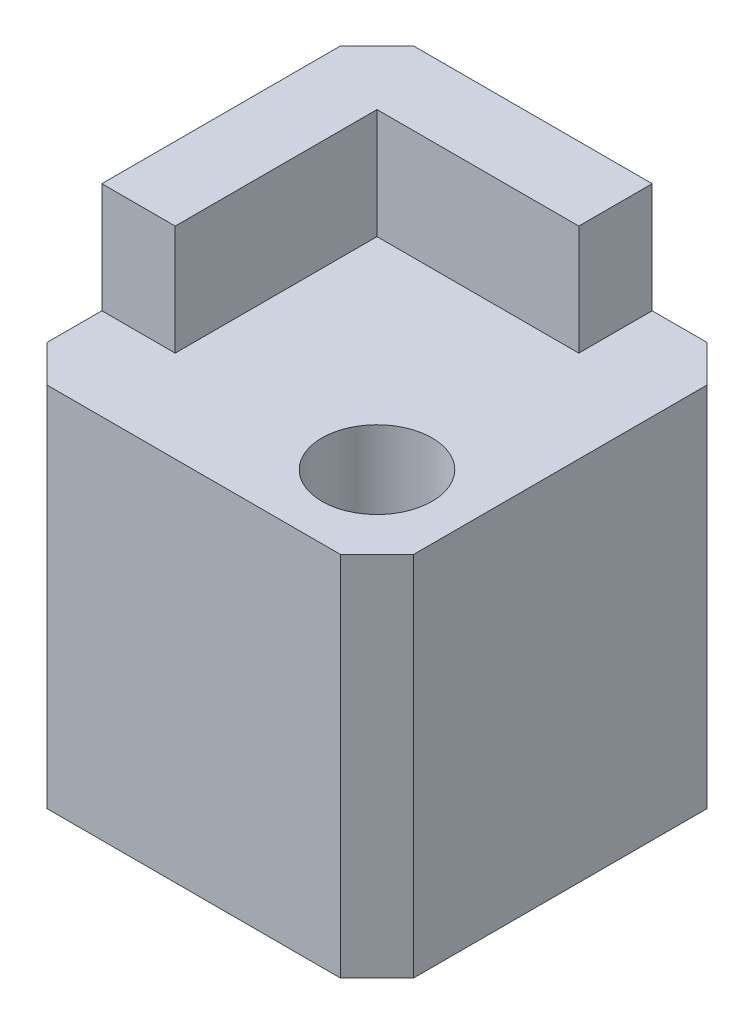
from build123d import *

# Parameters (mm, degrees)
SKETCH1_W           = 10
SKETCH1_H           = 10
BOSS_EXTRUDE1_DEPTH = 10
BOSS_EXTRUDE2_DEPTH = 3
CHAMFER1_SIZE       = 1
SKETCH1_4_R         = 1.5
CUT_EXTRUDE1_DEPTH  = 15.577379737


with BuildPart() as part:
    # Sketch1 → Boss-Extrude1 (new body)
    with BuildSketch(Plane(origin=(0, 0, 0), x_dir=(1, 0, 0), z_dir=(0, 1, 0))):
        with Locations((-2.5, 2.5)):
            Rectangle(SKETCH1_W, SKETCH1_H)
    extrude(amount=-BOSS_EXTRUDE1_DEPTH)

    # Sketch1<3> → Boss-Extrude2 (add)
    with BuildSketch(Plane(origin=(0, 0, 0), x_dir=(1, 0, 0), z_dir=(0, 1, 0))):
        Polygon((-5.5, 5.5), (0, 5.5), (0, 7.5), (-7.5, 7.5), (-7.5, 0), (-5.5, 0), align=None)
    extrude(amount=BOSS_EXTRUDE2_DEPTH)

    # Chamfer1
    chamfer1_edges = [part.edges().sort_by_distance(p)[0] for p in [
        (-7.5, -3.5, -7.5),
        (2.5, -5, -7.5),
        (-7.5, -5, 2.5),
        (2.5, -5, 2.5),
    ]]
    chamfer(chamfer1_edges, length=CHAMFER1_SIZE)

    # Sketch1<4> → Cut-Extrude1 (cut, through all)
    with BuildSketch(Plane(origin=(0, 0, 0), x_dir=(1, 0, 0), z_dir=(0, 1, 0))):
        Circle(SKETCH1_4_R)
    extrude(amount=-CUT_EXTRUDE1_DEPTH, mode=Mode.SUBTRACT)


solid = part.part
